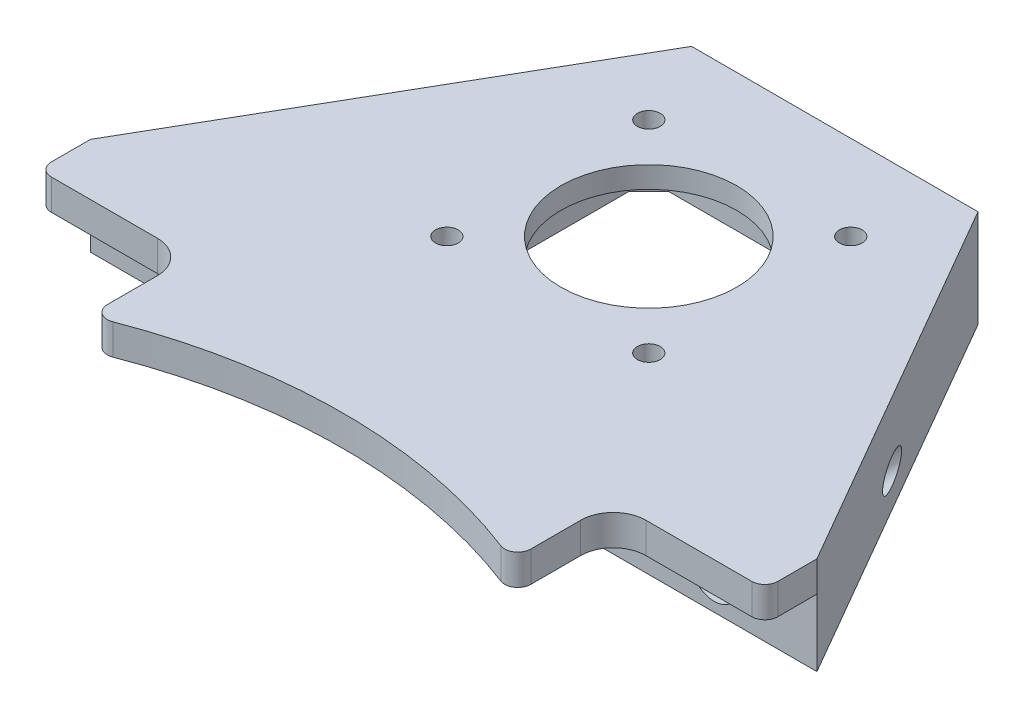
from build123d import *

# Parameters (mm, degrees)
BOSS_EXTRUDE1_DEPTH = 13.5
SKETCH2_W           = 45
SKETCH2_H           = 45
CUT_EXTRUDE1_DEPTH  = 11.72
SKETCH3_R           = 13.5
CUT_EXTRUDE2_DEPTH  = 84.329160712
CHAMFER1_SIZE       = 3
SKETCH7_W           = 113.25
SKETCH7_H           = 1.5
CUT_EXTRUDE4_DEPTH  = 84.598089841
SKETCH5_R           = 1.75
CUT_EXTRUDE7_DEPTH  = 84.013934059
BOSS_EXTRUDE2_START = 5
BOSS_EXTRUDE2_DEPTH = 20
CUT_EXTRUDE8_START  = -30
SKETCH11_W          = 111.517949192
SKETCH11_H          = 10.6
CUT_EXTRUDE8_DEPTH  = 30
SKETCH12_R          = 2
CUT_EXTRUDE9_DEPTH  = 83.19679585
SKETCH13_R          = 3.7
CUT_EXTRUDE10_DEPTH = 9.25
SKETCH14_R          = 83
CUT_EXTRUDE11_DEPTH = 9.25
FILLET1_R           = 5
SKETCH15_W          = 65
SKETCH15_H          = 8
CUT_EXTRUDE12_DEPTH = 9.25
FILLET2_R           = 2
SKETCH16_W          = 23.258974596
SKETCH16_H          = 14
BOSS_EXTRUDE3_DEPTH = 4.7
FILLET3_R           = 5
BOSS_EXTRUDE4_START = 1.5
SKETCH17_R          = 1.75
SKETCH17_R_2        = 13.5
BOSS_EXTRUDE4_DEPTH = 1.5
SKETCH18_W          = 153.260867966
SKETCH18_H          = 50.841882228
CUT_EXTRUDE13_DEPTH = 5


with BuildPart() as part:
    # Sketch1 → Boss-Extrude1 (new body)
    with BuildSketch(Plane(origin=(0, 0, 0), x_dir=(1, 0, 0), z_dir=(0, 1, 0))):
        Polygon((-56.625, 0), (56.625, 0), (21.983983849, 60), (-21.983983849, 60), align=None)
    extrude(amount=BOSS_EXTRUDE1_DEPTH)

    # Sketch2 → Cut-Extrude1 (cut)
    with BuildSketch(Plane.XZ):
        with Locations((0, -31.45)):
            Rectangle(SKETCH2_W, SKETCH2_H)
    extrude(amount=-CUT_EXTRUDE1_DEPTH, mode=Mode.SUBTRACT)

    # Sketch3 → Cut-Extrude2 (cut, through all)
    with BuildSketch(Plane.XZ.offset(-11.72)):
        with Locations(Location((0, -31.45, 0), (0, 0, 270))):
            Circle(SKETCH3_R)
    extrude(amount=-CUT_EXTRUDE2_DEPTH, mode=Mode.SUBTRACT)

    # Chamfer1
    chamfer1_edges = [part.edges().sort_by_distance(p)[0] for p in [
        (-22.5, 5.86, -8.95),
        (-22.5, 5.86, -53.95),
        (22.5, 5.86, -53.95),
        (22.5, 5.86, -8.95),
    ]]
    chamfer(chamfer1_edges, length=CHAMFER1_SIZE)

    # Sketch7 → Cut-Extrude4 (cut, through all)
    with BuildSketch(Plane(origin=(0, 13.5, 0), x_dir=(1, 0, 0), z_dir=(0, 1, 0))):
        with Locations((0, 0.75)):
            Rectangle(SKETCH7_W, SKETCH7_H)
    extrude(amount=-CUT_EXTRUDE4_DEPTH, mode=Mode.SUBTRACT)

    # Sketch5 → Cut-Extrude7 (cut, through all)
    with BuildSketch(Plane(origin=(0, 13.5, 0), x_dir=(1, 0, 0), z_dir=(0, 1, 0))):
        with Locations(Location((15.5, 46.95, 0), (0, 0, 270))):
            Circle(SKETCH5_R)
        with Locations(Location((15.5, 15.95, 0), (0, 0, 270))):
            Circle(SKETCH5_R)
        with Locations(Location((-15.5, 15.95, 0), (0, 0, 270))):
            Circle(SKETCH5_R)
        with Locations(Location((-15.5, 46.95, 0), (0, 0, 270))):
            Circle(SKETCH5_R)
    extrude(amount=-CUT_EXTRUDE7_DEPTH, mode=Mode.SUBTRACT)

    # Sketch10 → Boss-Extrude2 (add)
    with BuildSketch(Plane.XZ.offset(BOSS_EXTRUDE2_START)):
        Polygon((51.457715091, -8.95), (-51.457715091, -8.95), (-55.758974596, -1.5), (-55.758974596, 6.5), (-32.5, 6.5), (-32.5, 28.5), (32.5, 28.5), (32.5, 6.5), (55.758974596, 6.5), (55.758974596, -1.5), align=None)
    extrude(amount=-BOSS_EXTRUDE2_DEPTH)

    # Sketch11 → Cut-Extrude8 (cut)
    with BuildSketch(Plane.XY.offset(28.5).offset(CUT_EXTRUDE8_START)):
        with Locations((0, 5)):
            Rectangle(SKETCH11_W, SKETCH11_H)
    extrude(amount=CUT_EXTRUDE8_DEPTH, mode=Mode.SUBTRACT)

    # Sketch12 → Cut-Extrude9 (cut, through all)
    with BuildSketch(Plane.XY.offset(-1.5)):
        with Locations((-40, 5.15)):
            Circle(SKETCH12_R)
        with Locations((40, 5.15)):
            Circle(SKETCH12_R)
    extrude(amount=-CUT_EXTRUDE9_DEPTH, mode=Mode.SUBTRACT)

    # Sketch13 → Cut-Extrude10 (cut)
    with BuildSketch(Plane.XY.offset(-1.5)):
        with Locations((-40, 5.15)):
            Circle(SKETCH13_R)
        with Locations((40, 5.15)):
            Circle(SKETCH13_R)
    extrude(amount=-CUT_EXTRUDE10_DEPTH, mode=Mode.SUBTRACT)

    # Sketch14 → Cut-Extrude11 (cut)
    with BuildSketch(Plane(origin=(0, 15, 0), x_dir=(1, 0, 0), z_dir=(0, 1, 0))):
        with Locations((0, -98.5)):
            Circle(SKETCH14_R)
    extrude(amount=-CUT_EXTRUDE11_DEPTH, mode=Mode.SUBTRACT)

    # Fillet1
    fillet1_edges = [part.edges().sort_by_distance(p)[0] for p in [
        (-32.5, 12.65, 6.5),
        (32.5, 12.65, 6.5),
        (32.5, -2.65, 6.5),
        (-32.5, -2.65, 6.5),
    ]]
    fillet(fillet1_edges, radius=FILLET1_R)

    # Sketch15 → Cut-Extrude12 (cut)
    with BuildSketch(Plane.XZ.offset(5)):
        with Locations((0, 24.5)):
            Rectangle(SKETCH15_W, SKETCH15_H)
    extrude(amount=-CUT_EXTRUDE12_DEPTH, mode=Mode.SUBTRACT)

    # Fillet2
    fillet2_edges = [part.edges().sort_by_distance(p)[0] for p in [
        (-55.758974596, 12.65, 6.5),
        (55.758974596, 12.65, 6.5),
        (-32.5, 12.65, 22.127557326),
        (32.5, 12.65, 22.127557326),
    ]]
    fillet(fillet2_edges, radius=FILLET2_R)

    # Sketch16 → Boss-Extrude3 (add)
    with BuildSketch(Plane.XZ.offset(5)):
        with Locations((-44.129487298, 13.5)):
            Rectangle(SKETCH16_W, SKETCH16_H)
        with Locations((44.129487298, 13.5)):
            Rectangle(SKETCH16_W, SKETCH16_H)
    extrude(amount=-BOSS_EXTRUDE3_DEPTH)

    # Fillet3
    fillet3_edges = [part.edges().sort_by_distance(p)[0] for p in [
        (-55.758974596, -2.65, 20.5),
        (55.758974596, -2.65, 20.5),
    ]]
    fillet(fillet3_edges, radius=FILLET3_R)

    # Sketch17 → Boss-Extrude4 (add)
    with BuildSketch(Plane(origin=(0, 13.5, 0), x_dir=(1, 0, 0), z_dir=(0, 1, 0)).offset(BOSS_EXTRUDE4_START)):
        Polygon((-51.457715091, 8.95), (51.457715091, 8.95), (21.983983849, 60), (-21.983983849, 60), align=None)
        with Locations(Location((-15.5, 15.95, 0), (0, 0, 270))):
            Circle(SKETCH17_R, mode=Mode.SUBTRACT)
        with Locations(Location((-15.5, 46.95, 0), (0, 0, 270))):
            Circle(SKETCH17_R, mode=Mode.SUBTRACT)
        with Locations(Location((15.5, 46.95, 0), (0, 0, 270))):
            Circle(SKETCH17_R, mode=Mode.SUBTRACT)
        with Locations(Location((15.5, 15.95, 0), (0, 0, 270))):
            Circle(SKETCH17_R, mode=Mode.SUBTRACT)
        with Locations(Location((0, 31.45, 0), (0, 0, 90))):
            Circle(SKETCH17_R_2, mode=Mode.SUBTRACT)
    extrude(amount=-BOSS_EXTRUDE4_DEPTH)

    # Sketch18 → Cut-Extrude13 (cut)
    with BuildSketch(Plane.XZ.offset(5)):
        with Locations((-0.752597738, 9.037202)):
            Rectangle(SKETCH18_W, SKETCH18_H)
    extrude(amount=-CUT_EXTRUDE13_DEPTH, mode=Mode.SUBTRACT)


solid = part.part
